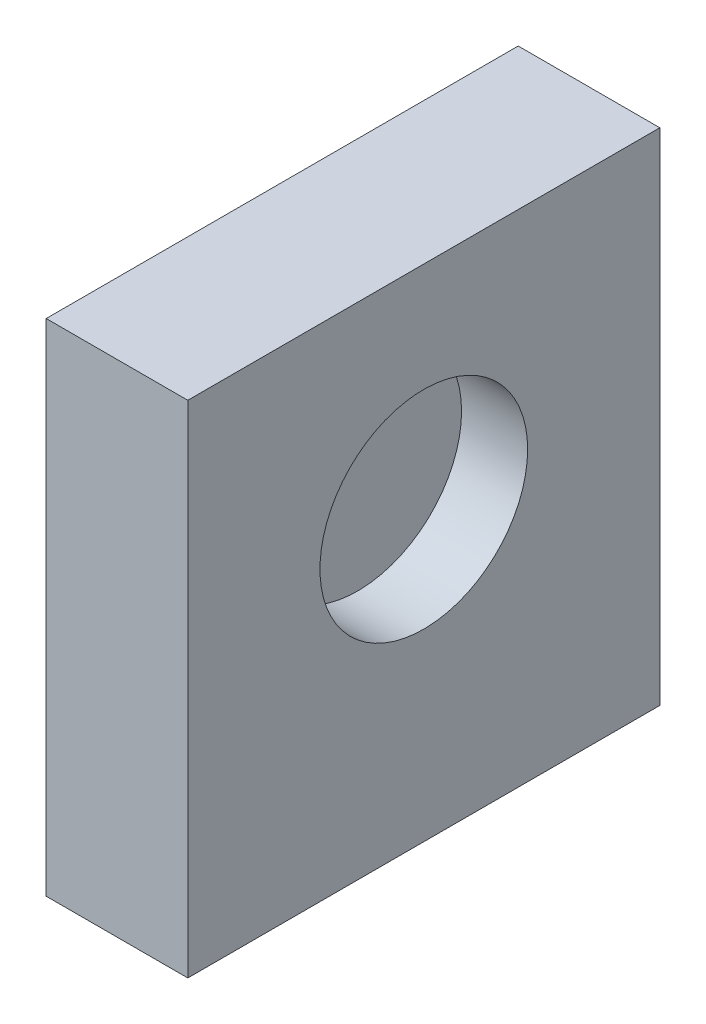
from build123d import *

# Parameters (mm, degrees)
CROQUIS1_W              = 50
CROQUIS1_H              = 53
SALIENTE_EXTRUIR1_DEPTH = 15
CROQUIS2_R              = 11
CORTAR_EXTRUIR1_DEPTH   = 7


with BuildPart() as part:
    # Croquis1 → Saliente-Extruir1 (new body)
    with BuildSketch(Plane(origin=(0, 0, 0), x_dir=(0, 0, -1), z_dir=(1, 0, 0))):
        Rectangle(CROQUIS1_W, CROQUIS1_H)
    extrude(amount=SALIENTE_EXTRUIR1_DEPTH)

    # Croquis2 → Cortar-Extruir1 (cut)
    with BuildSketch(Plane(origin=(15, 0, 0), x_dir=(0, 0, -1), z_dir=(1, 0, 0))):
        with Locations((0, 4)):
            Circle(CROQUIS2_R)
    extrude(amount=-CORTAR_EXTRUIR1_DEPTH, mode=Mode.SUBTRACT)


solid = part.part
